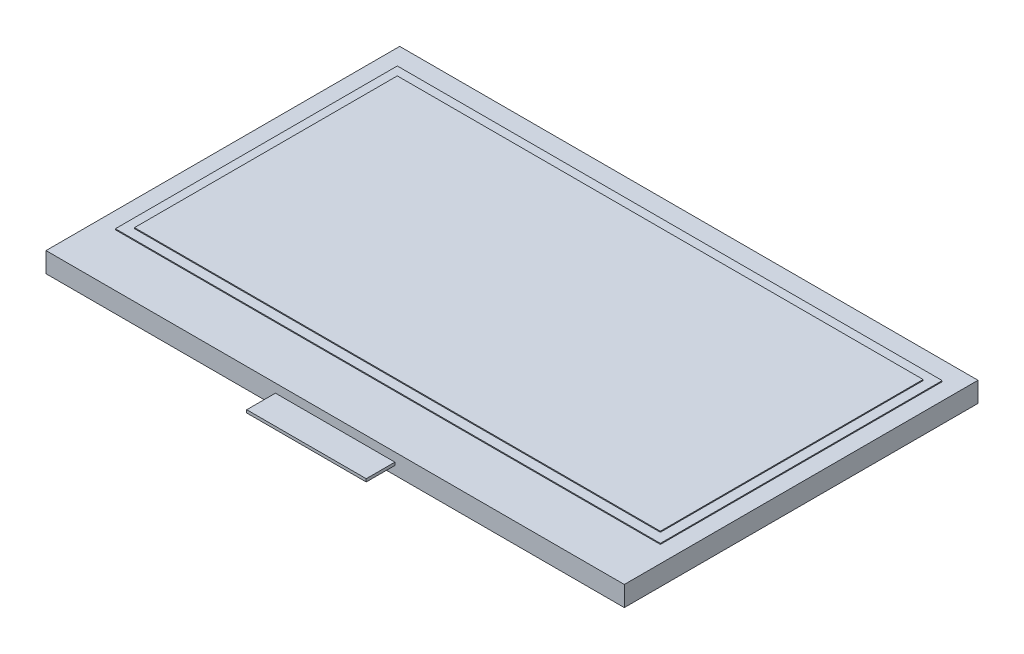
from build123d import *

# Parameters (mm, degrees)
SKETCH_1_W      = 60.5
SKETCH_1_H      = 37
EXTRUDE_1_DEPTH = 2.1
SKETCH_2_W      = 57.01
SKETCH_2_H      = 29.49
EXTRUDE_2_DEPTH = 0.1
SKETCH_5_W      = 55.01
SKETCH_5_H      = 27.49
EXTRUDE_4_DEPTH = 0.1
SKETCH_3_W      = 12.5
SKETCH_3_H      = 0.3
EXTRUDE_3_DEPTH = 3


with BuildPart() as part:
    # 草图1 → 凸台-拉伸1 (new body)
    with BuildSketch(Plane(origin=(0, 0, 0), x_dir=(1, 0, 0), z_dir=(0, 1, 0))):
        Rectangle(SKETCH_1_W, SKETCH_1_H)
    extrude(amount=EXTRUDE_1_DEPTH)

    # 草图2 → 凸台-拉伸2 (add)
    with BuildSketch(Plane(origin=(0, 2.1, 0), x_dir=(1, 0, 0), z_dir=(0, 1, 0))):
        with Locations((0.005, 1.755)):
            Rectangle(SKETCH_2_W, SKETCH_2_H)
    extrude(amount=EXTRUDE_2_DEPTH)

    # 草图5 → 凸台-拉伸4 (add)
    with BuildSketch(Plane(origin=(0, 2.2, 0), x_dir=(1, 0, 0), z_dir=(0, 1, 0))):
        with Locations((0.005, 1.755)):
            Rectangle(SKETCH_5_W, SKETCH_5_H)
    extrude(amount=EXTRUDE_4_DEPTH)

    # 草图3 → 凸台-拉伸3 (add)
    with BuildSketch(Plane.XY.offset(18.5)):
        with Locations((0, 1.031860601)):
            Rectangle(SKETCH_3_W, SKETCH_3_H)
    extrude(amount=EXTRUDE_3_DEPTH)


solid = part.part
